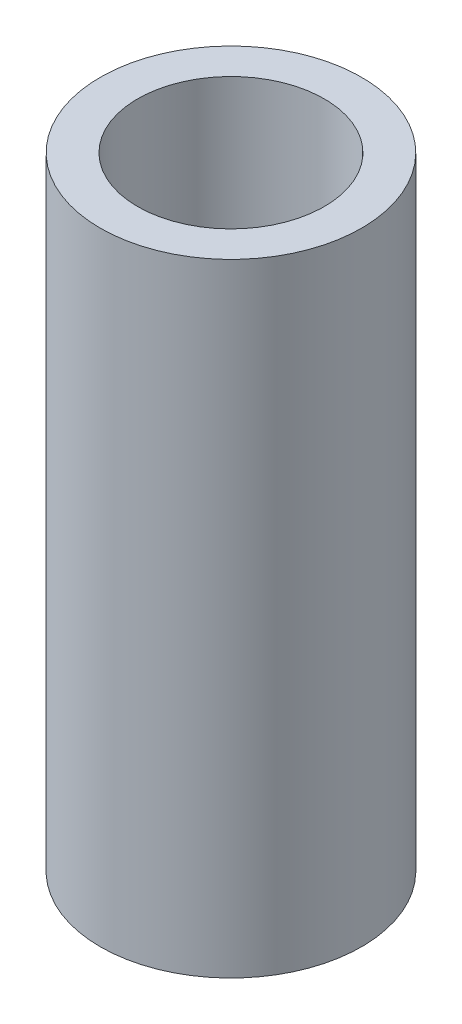
from build123d import *

# Parameters (mm, degrees)
SKETCH_1_R          = 10.5
EXTRUDE_1_DEPTH     = 50
SKETCH_2_R          = 7.5
CUT_EXTRUDE_2_DEPTH = 20


with BuildPart() as part:
    # Эскиз1 → Вытянуть1 (new body)
    with BuildSketch(Plane(origin=(0, 0, 0), x_dir=(1, 0, 0), z_dir=(0, 1, 0))):
        with Locations(Location((0, 0, 0), (0, 0, 270))):
            Circle(SKETCH_1_R)
    extrude(amount=EXTRUDE_1_DEPTH)

    # Эскиз2 → Вытянуть2 (cut)
    with BuildSketch(Plane(origin=(0, 50, 0), x_dir=(1, 0, 0), z_dir=(0, 1, 0))):
        with Locations(Location((0, 0, 0), (0, 0, 270))):
            Circle(SKETCH_2_R)
    extrude(amount=-CUT_EXTRUDE_2_DEPTH, mode=Mode.SUBTRACT)


solid = part.part
